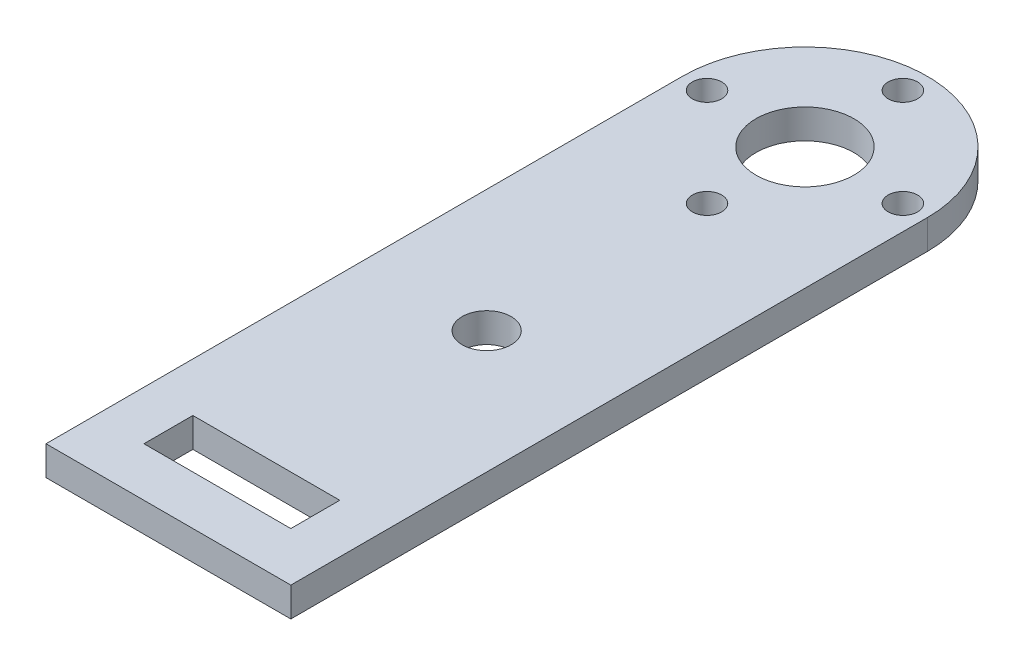
from build123d import *

# Parameters (mm, degrees)
SKETCH1_R           = 0.5
SKETCH1_W           = 1.5
SKETCH1_H           = 0.5
BOSS_EXTRUDE1_DEPTH = 0.3
SKETCH2_R           = 0.15
CUT_EXTRUDE1_DEPTH  = 0.3
CIRPATTERN1_COUNT   = 4
SKETCH5_R           = 0.25
CUT_EXTRUDE3_DEPTH  = 0.3


with BuildPart() as part:
    # Sketch1 → Boss-Extrude1 (new body)
    with BuildSketch(Plane(origin=(0, 0, 0), x_dir=(1, 0, 0), z_dir=(0, 1, 0))):
        with BuildLine():
            Line((0, 0), (2.5, 0))
            Line((2.5, 0), (2.5, 6.5))
            ThreePointArc((2.5, 6.5), (1.25, 7.75), (0, 6.5))
            Line((0, 6.5), (0, 0))
        make_face()
        with Locations(Location((1.25, 6.5, 0), (0, 0, 270))):
            Circle(SKETCH1_R, mode=Mode.SUBTRACT)
        with Locations((1.25, 0.75)):
            Rectangle(SKETCH1_W, SKETCH1_H, mode=Mode.SUBTRACT)
    extrude(amount=BOSS_EXTRUDE1_DEPTH)

    # Sketch2 → Cut-Extrude1 (cut)
    with BuildSketch(Plane(origin=(0, 0.3, 0), x_dir=(1, 0, 0), z_dir=(0, 1, 0))):
        with Locations(Location((0.25, 6.5, 0), (0, 0, 270))):
            Circle(SKETCH2_R)
    cut_extrude1 = extrude(amount=-CUT_EXTRUDE1_DEPTH, mode=Mode.SUBTRACT)

    # CirPattern1: Cut-Extrude1 ×4 about axis
    cirpattern1_axis = Axis((1.25, 0, -6.5), (0, 1, 0))
    for i in range(1, CIRPATTERN1_COUNT):
        add(cut_extrude1.rotate(cirpattern1_axis, i * 360 / CIRPATTERN1_COUNT), mode=Mode.SUBTRACT)

    # Sketch5 → Cut-Extrude3 (cut)
    with BuildSketch(Plane(origin=(0, 0.3, 0), x_dir=(1, 0, 0), z_dir=(0, 1, 0))):
        with Locations(Location((1.25, 3.25, 0), (0, 0, 270))):
            Circle(SKETCH5_R)
    extrude(amount=-CUT_EXTRUDE3_DEPTH, mode=Mode.SUBTRACT)


solid = part.part
